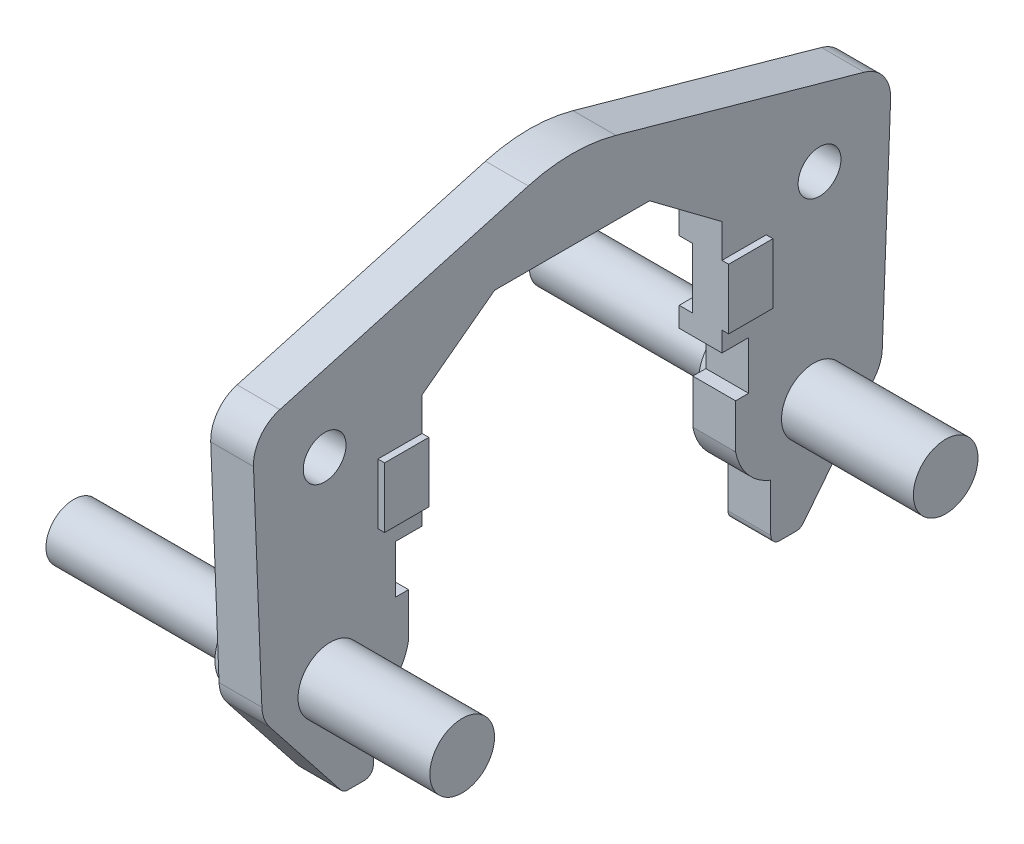
from build123d import *

# Parameters (mm, degrees)
SKETCH2_R           = 3.0099
BOSS_EXTRUDE1_DEPTH = 6.0198
SKETCH3_R           = 4.5466
SKETCH3_W           = 6.223
SKETCH3_H           = 8.4836
BOSS_EXTRUDE2_DEPTH = 0.9398
SKETCH4_R           = 4.5466
BOSS_EXTRUDE3_DEPTH = 17.6022
SKETCH5_W           = 6.223
SKETCH5_H           = 8.4836
CUT_EXTRUDE1_DEPTH  = 1.8542
SKETCH6_R           = 5.969
BOSS_EXTRUDE4_DEPTH = 1.8542
SKETCH9_R           = 6.985
BOSS_EXTRUDE6_DEPTH = 2.5654
DRAFT2_ANGLE        = -25
DRAFT3_ANGLE        = -25
SKETCH12_R          = 3.8989
BOSS_EXTRUDE7_DEPTH = 25.654


with BuildPart() as part:
    # Sketch2 → Boss-Extrude1 (new body)
    with BuildSketch(Plane(origin=(0, 0, 0), x_dir=(0, 0, -1), z_dir=(1, 0, 0))):
        with BuildLine():
            ThreePointArc((-32.512356648, -30.822448246), (-32.069394739, -31.178374506), (-31.515555535, -31.3055))
            Line((-31.515555535, -31.3055), (-29.21, -31.3055))
            ThreePointArc((-29.21, -31.3055), (-28.311974388, -30.933525612), (-27.94, -30.0355))
            Line((-27.94, -30.0355), (-27.94, -23.3045))
            ThreePointArc((-27.94, -23.3045), (-24.700446352, -20.987224463), (-22.998148855, -17.3863))
            Line((-22.998148855, -17.3863), (-22.998148855, -11.1633))
            Line((-22.998148855, -11.1633), (-24.8285, -11.1633))
            Line((-24.8285, -11.1633), (-24.8285, -4.3815))
            Line((-24.8285, -4.3815), (-21.082, -4.3815))
            Line((-21.082, -4.3815), (-21.082, 11.6205))
            Line((-21.082, 11.6205), (-10.8966, 19.2405))
            Line((-10.8966, 19.2405), (10.8966, 19.2405))
            Line((10.8966, 19.2405), (21.082, 11.6205))
            Line((21.082, 11.6205), (21.082, -4.3815))
            Line((21.082, -4.3815), (24.8285, -4.3815))
            Line((24.8285, -4.3815), (24.8285, -11.1633))
            Line((24.8285, -11.1633), (22.998148855, -11.1633))
            Line((22.998148855, -11.1633), (22.998148855, -17.3863))
            ThreePointArc((22.998148855, -17.3863), (24.700446352, -20.987224463), (27.94, -23.3045))
            Line((27.94, -23.3045), (27.94, -30.0355))
            ThreePointArc((27.94, -30.0355), (28.311974388, -30.933525612), (29.21, -31.3055))
            Line((29.21, -31.3055), (31.515555535, -31.3055))
            ThreePointArc((31.515555535, -31.3055), (32.069394739, -31.178374506), (32.512356648, -30.822448246))
            Line((32.512356648, -30.822448246), (42.536992541, -18.124576114))
            ThreePointArc((42.536992541, -18.124576114), (43.315187388, -16.736717659), (43.625872471, -15.176200729))
            Line((43.625872471, -15.176200729), (44.800437362, 14.721814671))
            ThreePointArc((44.800437362, 14.721814671), (43.830873172, 17.911699115), (41.092535101, 19.813519845))
            Line((41.092535101, 19.813519845), (6.15681953, 29.583677589))
            ThreePointArc((6.15681953, 29.583677589), (0, 30.428383513), (-6.15681953, 29.583677589))
            Line((-6.15681953, 29.583677589), (-41.092535101, 19.813519845))
            ThreePointArc((-41.092535101, 19.813519845), (-43.830873172, 17.911699115), (-44.800437362, 14.721814671))
            Line((-44.800437362, 14.721814671), (-43.625872471, -15.176200729))
            ThreePointArc((-43.625872471, -15.176200729), (-43.315187388, -16.736717659), (-42.536992541, -18.124576114))
            Line((-42.536992541, -18.124576114), (-32.512356648, -30.822448246))
        make_face()
        with Locations((-34.798, 10.8585)):
            Circle(SKETCH2_R, mode=Mode.SUBTRACT)
        with Locations((34.798, 10.8585)):
            Circle(SKETCH2_R, mode=Mode.SUBTRACT)
    extrude(amount=BOSS_EXTRUDE1_DEPTH)

    # Sketch3 → Boss-Extrude2 (add)
    with BuildSketch(Plane(origin=(6.0198, 0, 0), x_dir=(0, 0, -1), z_dir=(1, 0, 0))):
        with Locations((33.9979, -16.616175495)):
            Circle(SKETCH3_R)
        with Locations((-33.9979, -16.616175495)):
            Circle(SKETCH3_R)
        with Locations((24.1935, 2.6543)):
            Rectangle(SKETCH3_W, SKETCH3_H)
        with Locations((-24.1935, 2.6543)):
            Rectangle(SKETCH3_W, SKETCH3_H)
    extrude(amount=BOSS_EXTRUDE2_DEPTH)

    # Sketch4 → Boss-Extrude3 (add)
    with BuildSketch(Plane(origin=(6.9596, 0, 0), x_dir=(0, 0, -1), z_dir=(1, 0, 0))):
        with Locations((-33.9979, -16.616175495)):
            Circle(SKETCH4_R)
        with Locations((33.9979, -16.616175495)):
            Circle(SKETCH4_R)
    extrude(amount=BOSS_EXTRUDE3_DEPTH)

    # Sketch5 → Cut-Extrude1 (cut)
    with BuildSketch(Plane.ZY):
        with Locations((-24.1935, 2.6543)):
            Rectangle(SKETCH5_W, SKETCH5_H)
        with Locations((24.1935, 2.6543)):
            Rectangle(SKETCH5_W, SKETCH5_H)
    extrude(amount=-CUT_EXTRUDE1_DEPTH, mode=Mode.SUBTRACT)

    # Sketch6 → Boss-Extrude4 (add)
    with BuildSketch(Plane.ZY):
        with Locations(Location((33.9979, -16.616175495, 0), (0, 0, 180))):
            Circle(SKETCH6_R)
        with Locations(Location((-33.9979, -16.616175495, 0), (0, 0, 180))):
            Circle(SKETCH6_R)
    extrude(amount=BOSS_EXTRUDE4_DEPTH)

    # Sketch9 → Boss-Extrude6 (add)
    with BuildSketch(Plane.ZY.offset(1.8542)):
        with Locations((33.9979, -16.616175495)):
            Circle(SKETCH9_R)
        with Locations(Location((-33.9979, -16.616175495, 0), (0, 0, 180))):
            Circle(SKETCH9_R)
    extrude(amount=BOSS_EXTRUDE6_DEPTH)

    # Draft2
    draft2_faces = [part.faces().sort_by_distance(p)[0] for p in [
        (-3.1369, -16.616175495, -27.0129),
    ]]
    draft(draft2_faces, Plane(origin=(-1.8542, -16.616175495, -33.9979), x_dir=(0, 0, 1), z_dir=(1, 0, 0)), DRAFT2_ANGLE)

    # Draft3
    draft3_faces = [part.faces().sort_by_distance(p)[0] for p in [
        (-3.1369, -16.616175495, 27.0129),
    ]]
    draft(draft3_faces, Plane(origin=(-1.8542, -16.616175495, 33.9979), x_dir=(0, 0, 1), z_dir=(1, 0, 0)), DRAFT3_ANGLE)

    # Sketch12 → Boss-Extrude7 (add)
    with BuildSketch(Plane.ZY.offset(4.4196)):
        with Locations((-33.9979, -16.616175495)):
            Circle(SKETCH12_R)
        with Locations(Location((33.9979, -16.616175495, 0), (0, 0, 180))):
            Circle(SKETCH12_R)
    extrude(amount=BOSS_EXTRUDE7_DEPTH)


solid = part.part
